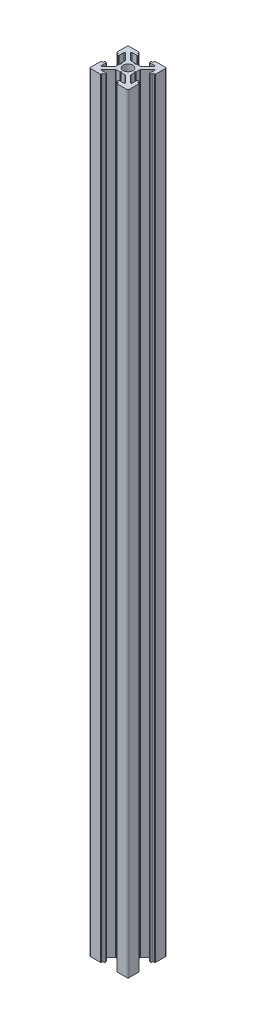
from build123d import *

# Parameters (mm, degrees)
SKETCH2_R                 = 2.5
VUONG_NHOMDH20X20_1_DEPTH = 400


with BuildPart() as part:
    # Sketch2 → Vuong NHOMDH20X20(1) (new body)
    with BuildSketch(Plane.ZX):
        with BuildLine():
            Line((0.385672566, 3.9), (2.360735931, 3.9))
            ThreePointArc((2.360735931, 3.9), (2.475540961, 3.92283614), (2.572867966, 3.987867966))
            Line((2.572867966, 3.987867966), (6.072867966, 7.487867966))
            ThreePointArc((6.072867966, 7.487867966), (6.137899791, 7.81480503), (5.860735931, 8))
            Line((5.860735931, 8), (3.4, 8))
            ThreePointArc((3.4, 8), (3.187867966, 8.087867966), (3.1, 8.3))
            Line((3.1, 8.3), (3.1, 8.7))
            ThreePointArc((3.1, 8.7), (3.187867966, 8.912132034), (3.4, 9))
            Line((3.4, 9), (3.8, 9))
            ThreePointArc((3.8, 9), (4.012132034, 9.087867966), (4.1, 9.3))
            Line((4.1, 9.3), (4.1, 9.7))
            ThreePointArc((4.1, 9.7), (4.187867966, 9.912132034), (4.4, 10))
            Line((4.4, 10), (9.5, 10))
            ThreePointArc((9.5, 10), (9.853553391, 9.853553391), (10, 9.5))
            Line((10, 9.5), (10, 4.4))
            ThreePointArc((10, 4.4), (9.912132034, 4.187867966), (9.7, 4.1))
            Line((9.7, 4.1), (9.3, 4.1))
            ThreePointArc((9.3, 4.1), (9.087867966, 4.012132034), (9, 3.8))
            Line((9, 3.8), (9, 3.4))
            ThreePointArc((9, 3.4), (8.912132034, 3.187867966), (8.7, 3.1))
            Line((8.7, 3.1), (8.3, 3.1))
            ThreePointArc((8.3, 3.1), (8.087867966, 3.187867966), (8, 3.4))
            Line((8, 3.4), (8, 5.860735931))
            ThreePointArc((8, 5.860735931), (7.81480503, 6.137899791), (7.487867966, 6.072867966))
            Line((7.487867966, 6.072867966), (3.987867966, 2.572867966))
            ThreePointArc((3.987867966, 2.572867966), (3.92283614, 2.475540961), (3.9, 2.360735931))
            Line((3.9, 2.360735931), (3.9, 0.385672566))
            Line((3.9, 0.385672566), (3.440373334, 0))
            Line((3.440373334, 0), (3.9, -0.385672566))
            Line((3.9, -0.385672566), (3.9, -2.360735931))
            ThreePointArc((3.9, -2.360735931), (3.92283614, -2.475540961), (3.987867966, -2.572867966))
            Line((3.987867966, -2.572867966), (7.487867966, -6.072867966))
            ThreePointArc((7.487867966, -6.072867966), (7.81480503, -6.137899791), (8, -5.860735931))
            Line((8, -5.860735931), (8, -3.4))
            ThreePointArc((8, -3.4), (8.087867966, -3.187867966), (8.3, -3.1))
            Line((8.3, -3.1), (8.7, -3.1))
            ThreePointArc((8.7, -3.1), (8.912132034, -3.187867966), (9, -3.4))
            Line((9, -3.4), (9, -3.8))
            ThreePointArc((9, -3.8), (9.087867966, -4.012132034), (9.3, -4.1))
            Line((9.3, -4.1), (9.7, -4.1))
            ThreePointArc((9.7, -4.1), (9.912132034, -4.187867966), (10, -4.4))
            Line((10, -4.4), (10, -9.5))
            ThreePointArc((10, -9.5), (9.853553391, -9.853553391), (9.5, -10))
            Line((9.5, -10), (4.4, -10))
            ThreePointArc((4.4, -10), (4.187867966, -9.912132034), (4.1, -9.7))
            Line((4.1, -9.7), (4.1, -9.3))
            ThreePointArc((4.1, -9.3), (4.012132034, -9.087867966), (3.8, -9))
            Line((3.8, -9), (3.4, -9))
            ThreePointArc((3.4, -9), (3.187867966, -8.912132034), (3.1, -8.7))
            Line((3.1, -8.7), (3.1, -8.3))
            ThreePointArc((3.1, -8.3), (3.187867966, -8.087867966), (3.4, -8))
            Line((3.4, -8), (5.860735931, -8))
            ThreePointArc((5.860735931, -8), (6.137899791, -7.81480503), (6.072867966, -7.487867966))
            Line((6.072867966, -7.487867966), (2.572867966, -3.987867966))
            ThreePointArc((2.572867966, -3.987867966), (2.475540961, -3.92283614), (2.360735931, -3.9))
            Line((2.360735931, -3.9), (0.385672566, -3.9))
            Line((0.385672566, -3.9), (0, -3.440373334))
            Line((0, -3.440373334), (-0.385672566, -3.9))
            Line((-0.385672566, -3.9), (-2.360735931, -3.9))
            ThreePointArc((-2.360735931, -3.9), (-2.475540961, -3.92283614), (-2.572867966, -3.987867966))
            Line((-2.572867966, -3.987867966), (-6.072867966, -7.487867966))
            ThreePointArc((-6.072867966, -7.487867966), (-6.137899791, -7.81480503), (-5.860735931, -8))
            Line((-5.860735931, -8), (-3.4, -8))
            ThreePointArc((-3.4, -8), (-3.187867966, -8.087867966), (-3.1, -8.3))
            Line((-3.1, -8.3), (-3.1, -8.7))
            ThreePointArc((-3.1, -8.7), (-3.187867966, -8.912132034), (-3.4, -9))
            Line((-3.4, -9), (-3.8, -9))
            ThreePointArc((-3.8, -9), (-4.012132034, -9.087867966), (-4.1, -9.3))
            Line((-4.1, -9.3), (-4.1, -9.7))
            ThreePointArc((-4.1, -9.7), (-4.187867966, -9.912132034), (-4.4, -10))
            Line((-4.4, -10), (-9.5, -10))
            ThreePointArc((-9.5, -10), (-9.853553391, -9.853553391), (-10, -9.5))
            Line((-10, -9.5), (-10, -4.4))
            ThreePointArc((-10, -4.4), (-9.912132034, -4.187867966), (-9.7, -4.1))
            Line((-9.7, -4.1), (-9.3, -4.1))
            ThreePointArc((-9.3, -4.1), (-9.087867966, -4.012132034), (-9, -3.8))
            Line((-9, -3.8), (-9, -3.4))
            ThreePointArc((-9, -3.4), (-8.912132034, -3.187867966), (-8.7, -3.1))
            Line((-8.7, -3.1), (-8.3, -3.1))
            ThreePointArc((-8.3, -3.1), (-8.087867966, -3.187867966), (-8, -3.4))
            Line((-8, -3.4), (-8, -5.860735931))
            ThreePointArc((-8, -5.860735931), (-7.81480503, -6.137899791), (-7.487867966, -6.072867966))
            Line((-7.487867966, -6.072867966), (-3.987867966, -2.572867966))
            ThreePointArc((-3.987867966, -2.572867966), (-3.92283614, -2.475540961), (-3.9, -2.360735931))
            Line((-3.9, -2.360735931), (-3.9, -0.385672566))
            Line((-3.9, -0.385672566), (-3.440373334, 0))
            Line((-3.440373334, 0), (-3.9, 0.385672566))
            Line((-3.9, 0.385672566), (-3.9, 2.360735931))
            ThreePointArc((-3.9, 2.360735931), (-3.92283614, 2.475540961), (-3.987867966, 2.572867966))
            Line((-3.987867966, 2.572867966), (-7.487867966, 6.072867966))
            ThreePointArc((-7.487867966, 6.072867966), (-7.81480503, 6.137899791), (-8, 5.860735931))
            Line((-8, 5.860735931), (-8, 3.4))
            ThreePointArc((-8, 3.4), (-8.087867966, 3.187867966), (-8.3, 3.1))
            Line((-8.3, 3.1), (-8.7, 3.1))
            ThreePointArc((-8.7, 3.1), (-8.912132034, 3.187867966), (-9, 3.4))
            Line((-9, 3.4), (-9, 3.8))
            ThreePointArc((-9, 3.8), (-9.087867966, 4.012132034), (-9.3, 4.1))
            Line((-9.3, 4.1), (-9.7, 4.1))
            ThreePointArc((-9.7, 4.1), (-9.912132034, 4.187867966), (-10, 4.4))
            Line((-10, 4.4), (-10, 9.5))
            ThreePointArc((-10, 9.5), (-9.853553391, 9.853553391), (-9.5, 10))
            Line((-9.5, 10), (-4.4, 10))
            ThreePointArc((-4.4, 10), (-4.187867966, 9.912132034), (-4.1, 9.7))
            Line((-4.1, 9.7), (-4.1, 9.3))
            ThreePointArc((-4.1, 9.3), (-4.012132034, 9.087867966), (-3.8, 9))
            Line((-3.8, 9), (-3.4, 9))
            ThreePointArc((-3.4, 9), (-3.187867966, 8.912132034), (-3.1, 8.7))
            Line((-3.1, 8.7), (-3.1, 8.3))
            ThreePointArc((-3.1, 8.3), (-3.187867966, 8.087867966), (-3.4, 8))
            Line((-3.4, 8), (-5.860735931, 8))
            ThreePointArc((-5.860735931, 8), (-6.137899791, 7.81480503), (-6.072867966, 7.487867966))
            Line((-6.072867966, 7.487867966), (-2.572867966, 3.987867966))
            ThreePointArc((-2.572867966, 3.987867966), (-2.475540961, 3.92283614), (-2.360735931, 3.9))
            Line((-2.360735931, 3.9), (-0.385672566, 3.9))
            Line((-0.385672566, 3.9), (0, 3.440373334))
            Line((0, 3.440373334), (0.385672566, 3.9))
        make_face()
        Circle(SKETCH2_R, mode=Mode.SUBTRACT)
    extrude(amount=VUONG_NHOMDH20X20_1_DEPTH)


solid = part.part
